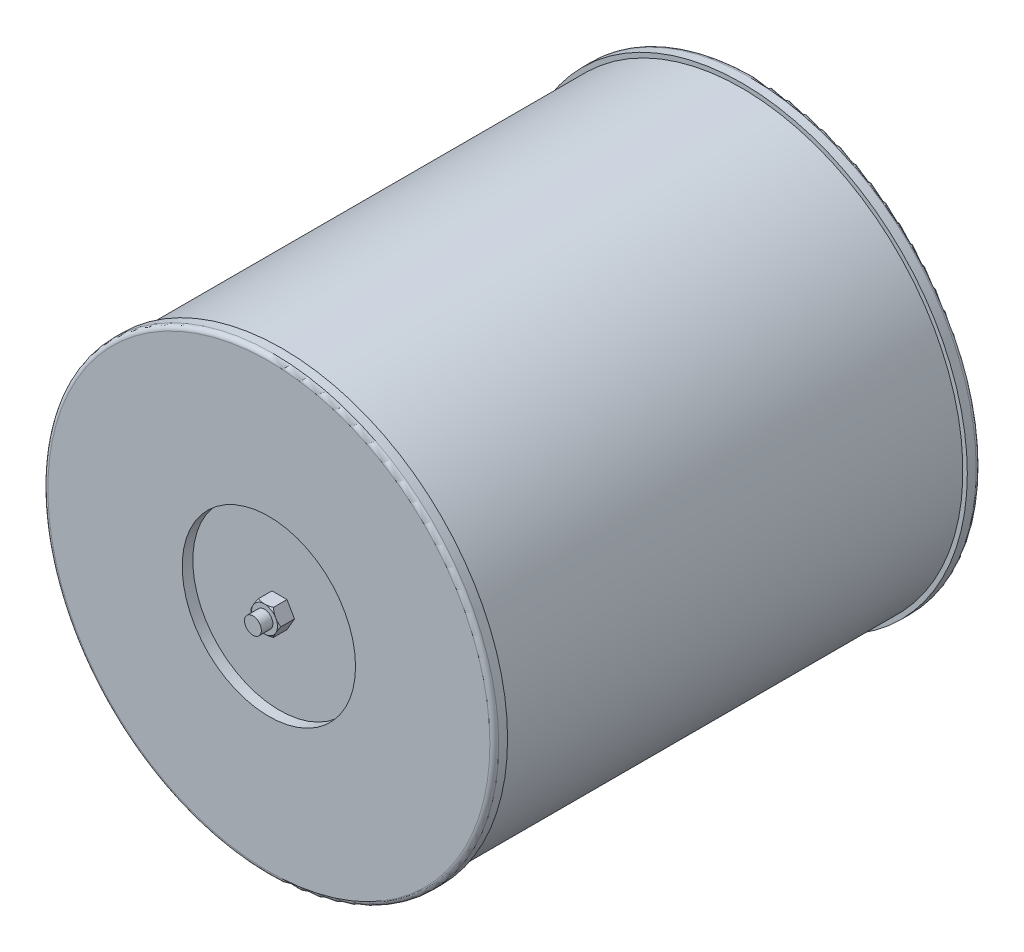
from build123d import *

# Parameters (mm, degrees)
CROQUIS1_R              = 165
SALIENTE_EXTRUIR1_DEPTH = 4
CROQUIS2_R              = 122
SALIENTE_EXTRUIR2_DEPTH = 50
CROQUIS3_R              = 250
SALIENTE_EXTRUIR3_DEPTH = 550
CROQUIS4_R              = 255
SALIENTE_EXTRUIR4_DEPTH = 15
SALIENTE_EXTRUIR5_START = -15
CROQUIS5_R              = 255
SALIENTE_EXTRUIR5_DEPTH = 15
REDONDEO1_R             = 5
CROQUIS6_R              = 98.024692722
CORTAR_EXTRUIR1_DEPTH   = 12
CROQUIS7_R              = 9.525
SALIENTE_EXTRUIR6_DEPTH = 30
SALIENTE_EXTRUIR7_DEPTH = 17
CROQUIS9_R              = 43.133819065
CROQUIS9_R_2            = 14.722431864
CORTAR_EXTRUIR2_DEPTH   = 10
CORTAR_EXTRUIR2_DRAFT   = -55


with BuildPart() as part:
    # Croquis1 → Saliente-Extruir1 (new body)
    with BuildSketch(Plane.XY):
        Circle(CROQUIS1_R)
    extrude(amount=SALIENTE_EXTRUIR1_DEPTH)

    # Croquis2 → Saliente-Extruir2 (add)
    with BuildSketch(Plane.XY.offset(4)):
        Circle(CROQUIS2_R)
    extrude(amount=SALIENTE_EXTRUIR2_DEPTH)

    # Croquis3 → Saliente-Extruir3 (add)
    with BuildSketch(Plane.XY.offset(54)):
        Circle(CROQUIS3_R)
    extrude(amount=SALIENTE_EXTRUIR3_DEPTH)

    # Croquis4 → Saliente-Extruir4 (add)
    with BuildSketch(Plane(origin=(0, 0, 54), x_dir=(-1, 0, 0), z_dir=(0, 0, -1))):
        Circle(CROQUIS4_R)
    extrude(amount=-SALIENTE_EXTRUIR4_DEPTH)

    # Croquis5 → Saliente-Extruir5 (add)
    with BuildSketch(Plane.XY.offset(604).offset(SALIENTE_EXTRUIR5_START)):
        with Locations(Location((0, 0, 0), (0, 0, 180))):
            Circle(CROQUIS5_R)
    extrude(amount=SALIENTE_EXTRUIR5_DEPTH)

    # Redondeo1
    redondeo1_edges = [part.edges().sort_by_distance(p)[0] for p in [
        (255, 0, 54),
        (255, 0, 604),
    ]]
    fillet(redondeo1_edges, radius=REDONDEO1_R)

    # Croquis6 → Cortar-Extruir1 (cut)
    with BuildSketch(Plane.XY.offset(604)):
        Circle(CROQUIS6_R)
    extrude(amount=-CORTAR_EXTRUIR1_DEPTH, mode=Mode.SUBTRACT)

    # Croquis7 → Saliente-Extruir6 (add)
    with BuildSketch(Plane.XY.offset(592)):
        Circle(CROQUIS7_R)
    extrude(amount=SALIENTE_EXTRUIR6_DEPTH)

    # Croquis8 → Saliente-Extruir7 (add)
    with BuildSketch(Plane.XY.offset(592)):
        Polygon((17, 0), (8.5, 14.722431864), (-8.5, 14.722431864), (-17, 0), (-8.5, -14.722431864), (8.5, -14.722431864), align=None)
    extrude(amount=SALIENTE_EXTRUIR7_DEPTH)


with BuildPart() as cortar_extruir2_tool:
    # Croquis9 → Cortar-Extruir2 (with draft: the straight prism first)
    with BuildSketch(Plane.XY.offset(609)):
        Circle(CROQUIS9_R)
        Circle(CROQUIS9_R_2, mode=Mode.SUBTRACT)
    extrude(amount=-CORTAR_EXTRUIR2_DEPTH)
    # Cortar-Extruir2: the draft: its side faces are tilted about the plane it starts from
    cortar_extruir2_sides = [cortar_extruir2_tool.faces().sort_by_distance(p)[0] for p in [
        (-43.133819065, 0, 604),
        (-14.722431864, 0, 604),
    ]]
    draft(cortar_extruir2_sides, Plane.XY.offset(609), CORTAR_EXTRUIR2_DRAFT)


with BuildPart() as part_1:
    add(part.part)

    # Cortar-Extruir2: cut by cortar_extruir2_tool
    add(cortar_extruir2_tool.part, mode=Mode.SUBTRACT)


solid = part_1.part
